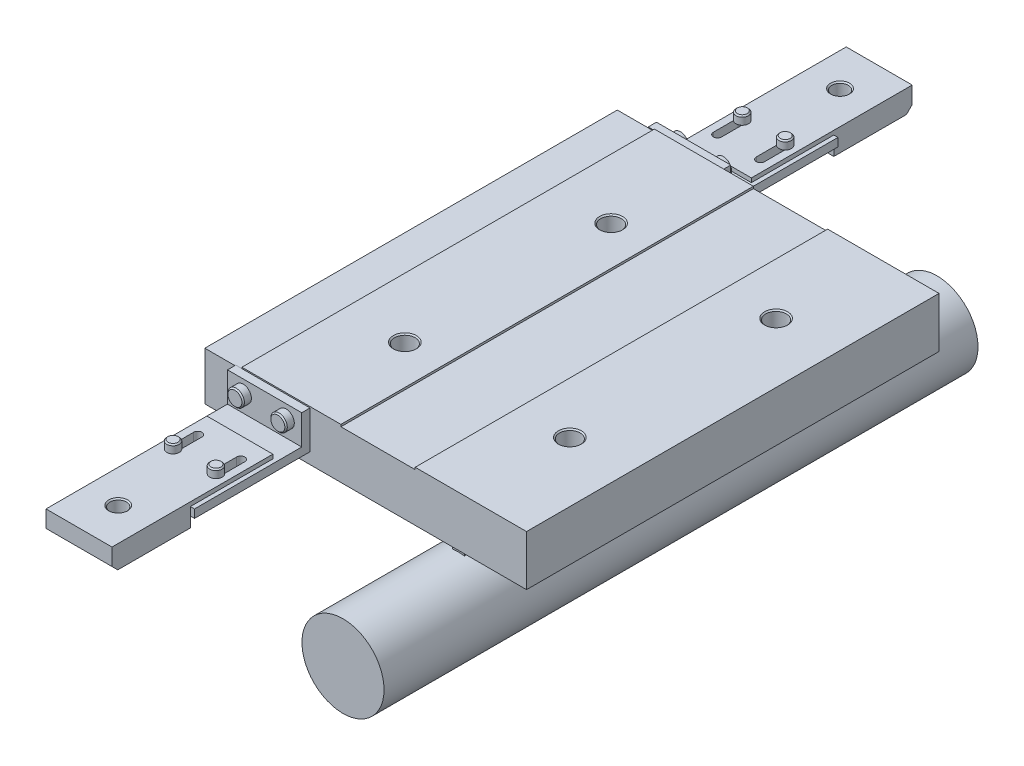
from build123d import *

# Parameters (mm, degrees)
SKETCH1_W                 = 45
SKETCH1_H                 = 12.2
BASE_EXTRUDE_DEPTH        = 50
SKETCH16_W                = 33
SKETCH16_H                = 100
TABLE_EXTENSION_DEPTH     = 12.2
SKETCH3_R                 = 2.5
MOUNTHOLES_DEPTH          = 8
SKETCH14_W                = 2.9
SKETCH14_H                = 28.5
CONNECTION_DEPTH          = 44
SKETCH15_R                = 9.95
PISTON_DEPTH              = 72
SKETCH17_W                = 9
SKETCH17_H                = 0.5
SKETCH17_W_2              = 18
GROOVES_DEPTH             = 138.879557948
ENDLOCKPLATE1_DEPTH       = 9
ENDLOCKPLATE2_DEPTH       = 8
SKETCH20_R                = 2
ENDLOCKHOLES_DEPTH        = 117.232751409
SKETCH21_R                = 1.5
ENDLOCKADJUSTSCREWS_DEPTH = 2
SKETCH23_R                = 2
ENDLOCKMOUNTSCREWS_DEPTH  = 2
CHAMFER1_SIZE             = 0.3


with BuildPart() as part:
    # Sketch1 → Base-Extrude (new, symmetric)
    with BuildSketch(Plane.XY):
        Rectangle(SKETCH1_W, SKETCH1_H)
    extrude(amount=BASE_EXTRUDE_DEPTH, both=True)

    # Sketch16 → Table_Extension (add)
    with BuildSketch(Plane(origin=(0, 6.1, 0), x_dir=(-1, 0, 0), z_dir=(0, 1, 0))):
        with Locations((39, 0)):
            Rectangle(SKETCH16_W, SKETCH16_H)
    extrude(amount=-TABLE_EXTENSION_DEPTH)

    # Sketch3 → MountHoles (cut)
    with BuildSketch(Plane(origin=(0, 6.1, 0), x_dir=(-1, 0, 0), z_dir=(0, 1, 0))):
        with Locations(Location((32, -25, 0), (0, 0, 90))):
            Circle(SKETCH3_R)
        with Locations(Location((-8, -25, 0), (0, 0, 270))):
            Circle(SKETCH3_R)
        with Locations(Location((32, 25, 0), (0, 0, 270))):
            Circle(SKETCH3_R)
        with Locations(Location((-8, 25, 0), (0, 0, 90))):
            Circle(SKETCH3_R)
    extrude(amount=-MOUNTHOLES_DEPTH, mode=Mode.SUBTRACT)

    # Sketch14 → Connection (add, symmetric)
    with BuildSketch(Plane.XY):
        with Locations((0, -8.15)):
            Rectangle(SKETCH14_W, SKETCH14_H)
    extrude(amount=CONNECTION_DEPTH, both=True)

    # Sketch15 → Piston (add, symmetric)
    with BuildSketch(Plane.XY):
        with Locations((0, -22.4)):
            Circle(SKETCH15_R)
    extrude(amount=PISTON_DEPTH, both=True)

    # Sketch17 → Grooves (cut, through all)
    with BuildSketch(Plane.XY.offset(50)):
        with Locations((-51, 5.85)):
            Rectangle(SKETCH17_W, SKETCH17_H)
        with Locations((-13.5, 5.85)):
            Rectangle(SKETCH17_W_2, SKETCH17_H)
    extrude(amount=-GROOVES_DEPTH, mode=Mode.SUBTRACT)

    # Sketch18 → EndLockPlate1 (add, symmetric)
    with BuildSketch(Plane(origin=(-39, 0, 0), x_dir=(0, 0, -1), z_dir=(1, 0, 0))):
        Polygon((-50, 5.8), (-52, 5.8), (-52, -1.4), (-78, -1.4), (-78, -3.4), (-50, -3.4), align=None)
    endlockplate1 = extrude(amount=ENDLOCKPLATE1_DEPTH, both=True)

    # Sketch19 → EndLockPlate2 (add, symmetric)
    with BuildSketch(Plane(origin=(-39, 0, 0), x_dir=(0, 0, -1), z_dir=(1, 0, 0))):
        Polygon((-58, -1.4), (-58, -0.4), (-97, -0.4), (-97, -4.5), (-95.6, -5.9), (-78, -5.9), (-78, -1.4), align=None)
    endlockplate2 = extrude(amount=ENDLOCKPLATE2_DEPTH, both=True)

    # Sketch20 → EndLockHoles (cut, through all)
    with BuildSketch(Plane(origin=(0, -0.4, 0), x_dir=(-1, 0, 0), z_dir=(0, 1, 0))):
        with Locations(Location((39, 87.5, 0), (0, 0, 90))):
            Circle(SKETCH20_R)
        with BuildLine():
            Line((32.8, 63), (32.8, 69))
            ThreePointArc((32.8, 69), (33.8, 70), (34.8, 69))
            Line((34.8, 69), (34.8, 63))
            ThreePointArc((34.8, 63), (33.8, 62), (32.8, 63))
        make_face()
        with BuildLine():
            Line((43.2, 69), (43.2, 63))
            ThreePointArc((43.2, 63), (44.2, 62), (45.2, 63))
            Line((45.2, 63), (45.2, 69))
            ThreePointArc((45.2, 69), (44.2, 70), (43.2, 69))
        make_face()
    endlockholes = extrude(amount=-ENDLOCKHOLES_DEPTH, mode=Mode.SUBTRACT)

    # Sketch21 → EndLockAdjustScrews (add)
    with BuildSketch(Plane(origin=(0, -0.4, 0), x_dir=(-1, 0, 0), z_dir=(0, 1, 0))):
        with Locations(Location((44.2, 69, 0), (0, 0, 228.189685104))):
            Circle(SKETCH21_R)
        with Locations(Location((33.8, 69, 0), (0, 0, 228.189685104))):
            Circle(SKETCH21_R)
    endlockadjustscrews = extrude(amount=ENDLOCKADJUSTSCREWS_DEPTH)

    # Sketch23 → EndLockMountScrews (add)
    with BuildSketch(Plane.XY.offset(52)):
        with Locations(Location((-44.2, 2.7, 0), (0, 0, 180))):
            Circle(SKETCH23_R)
        with Locations(Location((-33.8, 2.7, 0), (0, 0, 180))):
            Circle(SKETCH23_R)
    endlockmountscrews = extrude(amount=ENDLOCKMOUNTSCREWS_DEPTH)

    # EndLockMirror: EndLockPlate1, EndLockPlate2, EndLockHoles, EndLockAdjustScrews, EndLockMountScrews across plane
    add(endlockplate1.mirror(Plane.XY))
    add(endlockplate2.mirror(Plane.XY))
    add(endlockholes.mirror(Plane.XY), mode=Mode.SUBTRACT)
    add(endlockadjustscrews.mirror(Plane.XY))
    add(endlockmountscrews.mirror(Plane.XY))

    # Chamfer1
    chamfer1_edges = [part.edges().sort_by_distance(p)[0] for p in [
        (-39, -0.4, 85.5),
        (-45.2, 1.6, 70.118033989),
        (-34.8, 1.6, 70.118033989),
        (-42.2, 2.7, 54),
        (-31.8, 2.7, 54),
        (-39, -0.4, -85.5),
        (-32, 6.1, -27.5),
        (-45.2, 1.6, -70.118033989),
        (-34.8, 1.6, -70.118033989),
        (8, 6.1, -22.5),
        (-32, 6.1, 27.5),
        (8, 6.1, 22.5),
    ]]
    chamfer(chamfer1_edges, length=CHAMFER1_SIZE)


solid = part.part
